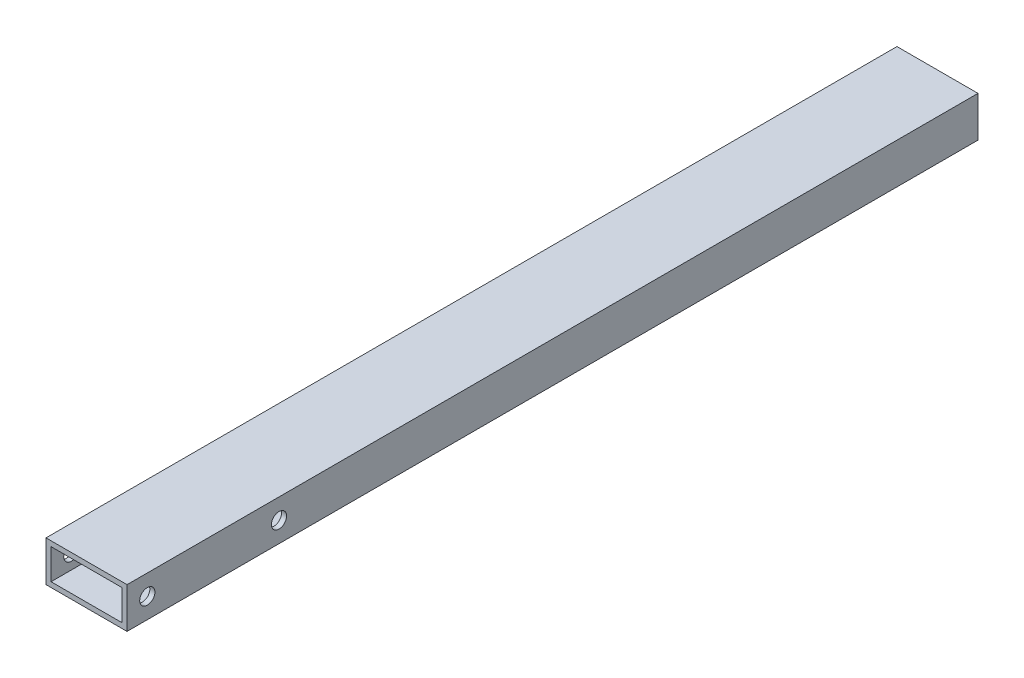
from build123d import *

# Parameters (mm, degrees)
SKETCH1_W           = 50.8
SKETCH1_H           = 25.4
SKETCH1_W_2         = 44.45
SKETCH1_H_2         = 19.05
BOSS_EXTRUDE1_DEPTH = 457.2
SKETCH2_R           = 4.7625
CUT_EXTRUDE1_DEPTH  = 461.188841673
SKETCH3_W           = 50.8
SKETCH3_H           = 25.4
SKETCH3_W_2         = 44.45
SKETCH3_H_2         = 19.05
BOSS_EXTRUDE2_DEPTH = 76.2
SKETCH4_R           = 4.7625
CUT_EXTRUDE2_DEPTH  = 536.964075289


with BuildPart() as part:
    # Sketch1 → Boss-Extrude1 (new body)
    with BuildSketch(Plane.XY):
        Rectangle(SKETCH1_W, SKETCH1_H)
        Rectangle(SKETCH1_W_2, SKETCH1_H_2, mode=Mode.SUBTRACT)
    extrude(amount=BOSS_EXTRUDE1_DEPTH)

    # Sketch2 → Cut-Extrude1 (cut, through all)
    with BuildSketch(Plane.ZY.offset(25.4)):
        with Locations((438.15, 0)):
            Circle(SKETCH2_R)
    extrude(amount=-CUT_EXTRUDE1_DEPTH, mode=Mode.SUBTRACT)

    # Sketch3 → Boss-Extrude2 (add)
    with BuildSketch(Plane.XY.offset(457.2)):
        Rectangle(SKETCH3_W, SKETCH3_H)
        Rectangle(SKETCH3_W_2, SKETCH3_H_2, mode=Mode.SUBTRACT)
    extrude(amount=BOSS_EXTRUDE2_DEPTH)

    # Sketch4 → Cut-Extrude2 (cut, through all)
    with BuildSketch(Plane.ZY.offset(25.4)):
        with Locations((520.7, 0)):
            Circle(SKETCH4_R)
    extrude(amount=-CUT_EXTRUDE2_DEPTH, mode=Mode.SUBTRACT)


solid = part.part
